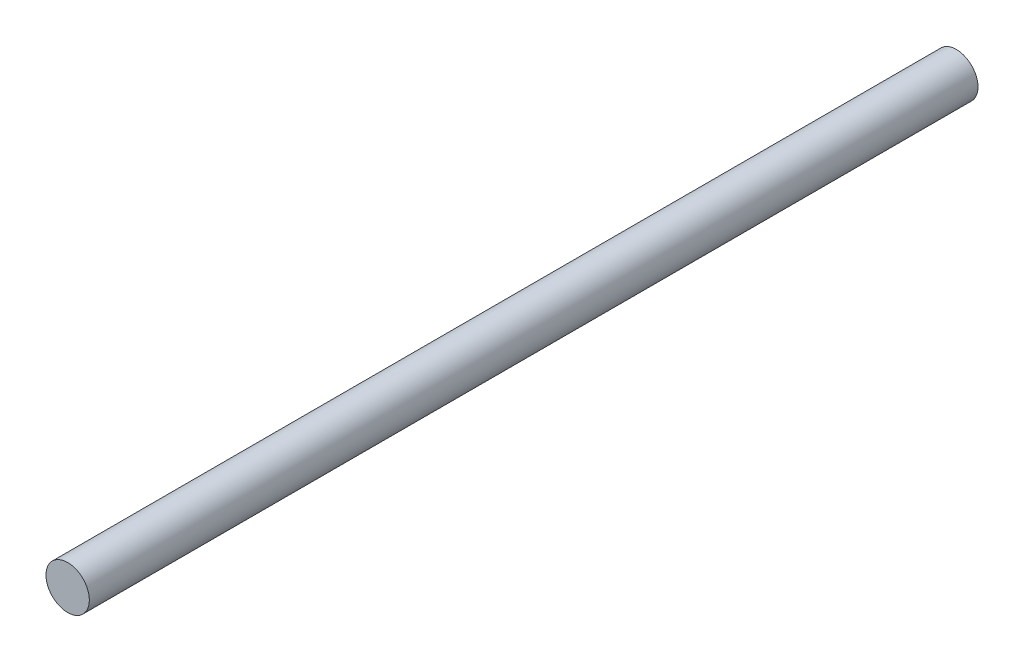
from build123d import *

# Parameters (mm, degrees)
SKETCH1_R           = 2.44
BOSS_EXTRUDE1_DEPTH = 100


with BuildPart() as part:
    # Sketch1 → Boss-Extrude1 (new body)
    with BuildSketch(Plane.XY):
        Circle(SKETCH1_R)
    extrude(amount=BOSS_EXTRUDE1_DEPTH)


solid = part.part
